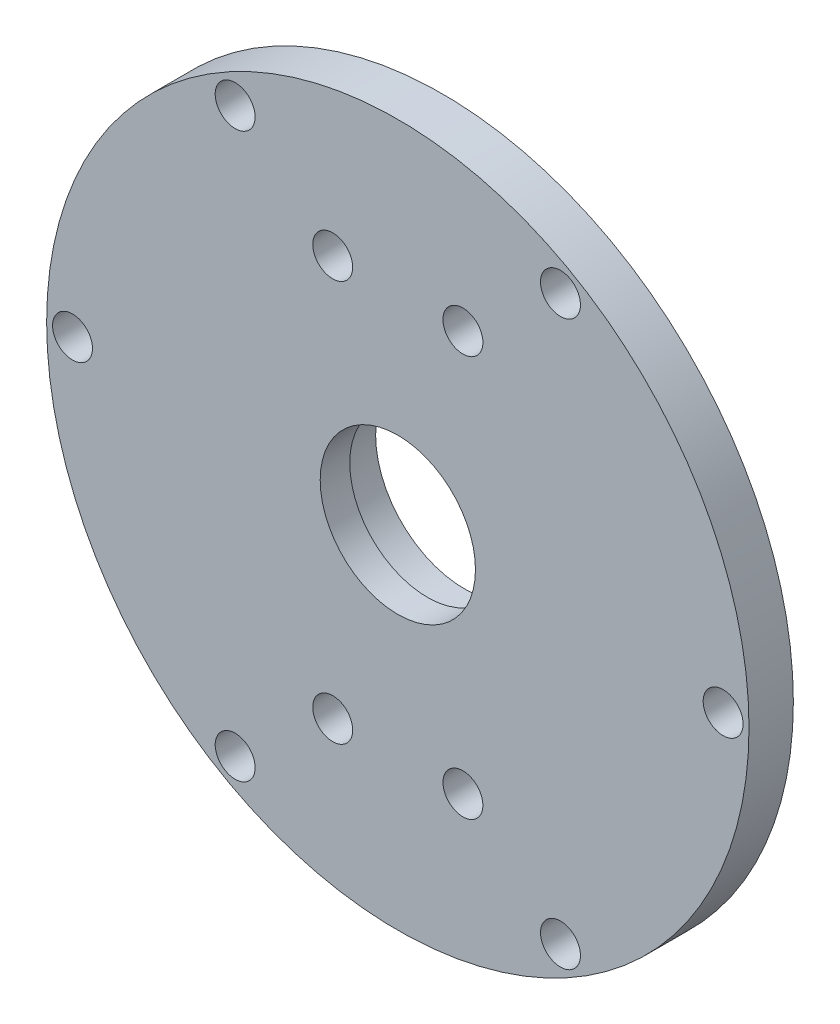
from build123d import *

# Parameters (mm, degrees)
SKETCH1_R           = 47.5
SKETCH1_R_2         = 10.5
SKETCH1_R_3         = 2.7
BOSS_EXTRUDE1_DEPTH = 6
SKETCH2_R           = 12
CUT_EXTRUDE1_DEPTH  = 2
BOSS_EXTRUDE2_START = 3
SKETCH3_R           = 16
SKETCH3_R_2         = 12
BOSS_EXTRUDE2_DEPTH = 3
SKETCH4_R           = 2.7
CUT_EXTRUDE2_DEPTH  = 5


with BuildPart() as part:
    # Sketch1 → Boss-Extrude1 (new body)
    with BuildSketch(Plane.XY):
        Circle(SKETCH1_R)
        Circle(SKETCH1_R_2, mode=Mode.SUBTRACT)
        with Locations((44, 0)):
            Circle(SKETCH1_R_3, mode=Mode.SUBTRACT)
        with Locations((22, -38.105117767)):
            Circle(SKETCH1_R_3, mode=Mode.SUBTRACT)
        with Locations((-22, -38.105117767)):
            Circle(SKETCH1_R_3, mode=Mode.SUBTRACT)
        with Locations((-44, 0)):
            Circle(SKETCH1_R_3, mode=Mode.SUBTRACT)
        with Locations((-22, 38.105117767)):
            Circle(SKETCH1_R_3, mode=Mode.SUBTRACT)
        with Locations((22, 38.105117767)):
            Circle(SKETCH1_R_3, mode=Mode.SUBTRACT)
    extrude(amount=BOSS_EXTRUDE1_DEPTH)

    # Sketch2 → Cut-Extrude1 (cut)
    with BuildSketch(Plane(origin=(0, 0, 0), x_dir=(-1, 0, 0), z_dir=(0, 0, -1))):
        Circle(SKETCH2_R)
    extrude(amount=-CUT_EXTRUDE1_DEPTH, mode=Mode.SUBTRACT)

    # Sketch3 → Boss-Extrude2 (add)
    with BuildSketch(Plane(origin=(0, 0, 0), x_dir=(-1, 0, 0), z_dir=(0, 0, -1)).offset(BOSS_EXTRUDE2_START)):
        with Locations(Location((0, 0, 0), (0, 0, 180))):
            Circle(SKETCH3_R)
        Circle(SKETCH3_R_2, mode=Mode.SUBTRACT)
    extrude(amount=-BOSS_EXTRUDE2_DEPTH)

    # Sketch4 → Cut-Extrude2 (cut)
    with BuildSketch(Plane.XY.offset(6)):
        with Locations((8.80698434, 27.105110714)):
            Circle(SKETCH4_R)
        with Locations(Location((-8.80698434, 27.105110714, 0), (0, 0, 180))):
            Circle(SKETCH4_R)
        with Locations(Location((8.80698434, -27.105110714, 0), (0, 0, 180))):
            Circle(SKETCH4_R)
        with Locations((-8.80698434, -27.105110714)):
            Circle(SKETCH4_R)
    extrude(amount=-CUT_EXTRUDE2_DEPTH, mode=Mode.SUBTRACT)


solid = part.part
